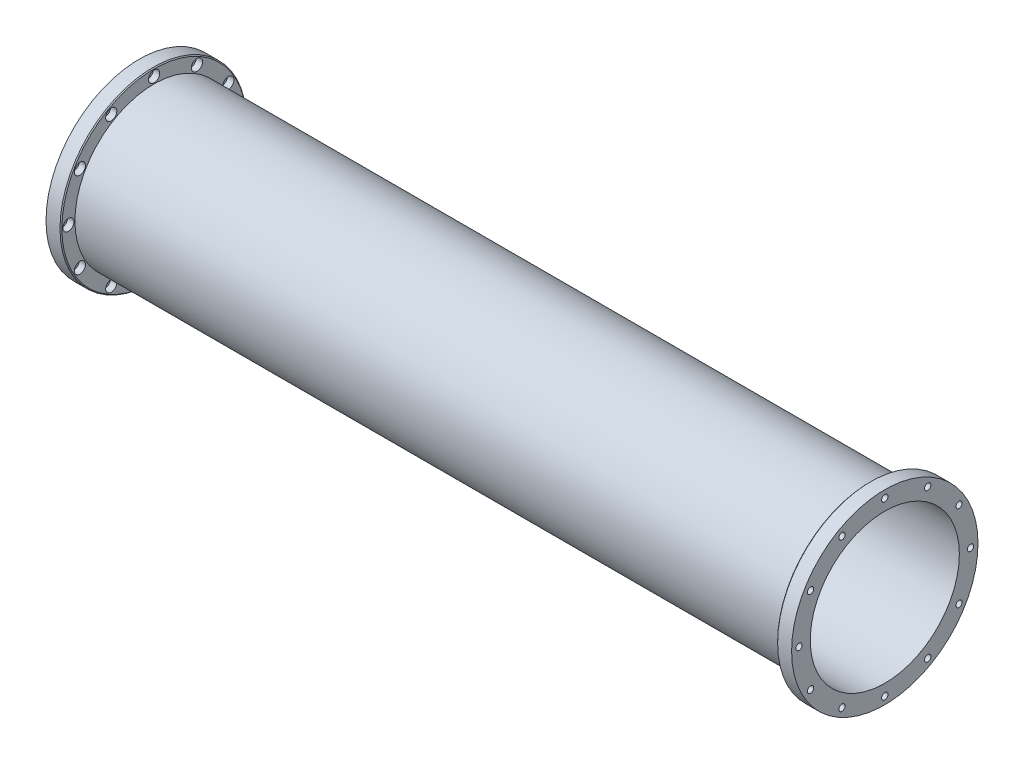
from build123d import *

# Parameters (mm, degrees)
SKETCH_4_R                = 40
CUT_EXTRUDE_1_DEPTH       = 407.201920232
HOLE_WIZARD_1_D           = 3.4
HOLE_WIZARD_1_DEPTH       = 8
HOLE_WIZARD_1_CBORE_D     = 6
HOLE_WIZARD_1_CBORE_DEPTH = 3.4
PATTERN_CIRCULAR_1_COUNT  = 12
HOLE_WIZARD_3_D           = 3.4
HOLE_WIZARD_3_DEPTH       = 8
HOLE_WIZARD_3_CBORE_D     = 6
HOLE_WIZARD_3_CBORE_DEPTH = 3.4
PATTERN_CIRCULAR_2_COUNT  = 12
CHAMFER_1_SIZE            = 0.5


with BuildPart() as part:
    # 草图3 → 旋转1 (revolve)
    with BuildSketch(Plane.XY, mode=Mode.PRIVATE) as revolve_1_sk:
        Polygon((0, 0), (0, 50), (8, 50), (8, 42.5), (392, 42.5), (392, 50), (400, 50), (400, 0), align=None)
    revolve(revolve_1_sk.sketch.rotate(Axis((-303.553299492, 0, 0), (1, 0, 0)), 90), axis=Axis((-303.553299492, 0, 0), (1, 0, 0)))

    # 草图4 → 切除-拉伸1 (cut, through all)
    with BuildSketch(Plane(origin=(400, 0, 0), x_dir=(0, 0, -1), z_dir=(1, 0, 0))):
        Circle(SKETCH_4_R)
    extrude(amount=-CUT_EXTRUDE_1_DEPTH, mode=Mode.SUBTRACT)

    # 打孔尺寸(%根据)内六角圆柱头螺钉的类型1
    with Locations(Plane.ZY.offset(-392)):
        with Locations((0, 46)):
            hole_wizard_1 = CounterBoreHole(HOLE_WIZARD_1_D / 2, HOLE_WIZARD_1_CBORE_D / 2, HOLE_WIZARD_1_CBORE_DEPTH, depth=HOLE_WIZARD_1_DEPTH)

    # 阵列(圆周)1: 打孔尺寸(%根据)内六角圆柱头螺钉的类型1 ×12 about axis
    pattern_circular_1_axis = Axis((0, 0, 0), (1, 0, 0))
    for i in range(1, PATTERN_CIRCULAR_1_COUNT):
        add(hole_wizard_1.rotate(pattern_circular_1_axis, i * 360 / PATTERN_CIRCULAR_1_COUNT), mode=Mode.SUBTRACT)

    # 打孔尺寸(%根据)内六角圆柱头螺钉的类型3
    with Locations(Plane(origin=(8, 0, 0), x_dir=(0, 0, -1), z_dir=(1, 0, 0))):
        with Locations((0, 46)):
            hole_wizard_3 = CounterBoreHole(HOLE_WIZARD_3_D / 2, HOLE_WIZARD_3_CBORE_D / 2, HOLE_WIZARD_3_CBORE_DEPTH, depth=HOLE_WIZARD_3_DEPTH)

    # 阵列(圆周)2: 打孔尺寸(%根据)内六角圆柱头螺钉的类型3 ×12 about axis
    pattern_circular_2_axis = Axis((0, 0, 0), (1, 0, 0))
    for i in range(1, PATTERN_CIRCULAR_2_COUNT):
        add(hole_wizard_3.rotate(pattern_circular_2_axis, i * 360 / PATTERN_CIRCULAR_2_COUNT), mode=Mode.SUBTRACT)

    # 倒角1
    chamfer_1_edges = [part.edges().sort_by_distance(p)[0] for p in [
        (392, 0, -50),
        (8, 0, -50),
    ]]
    chamfer(chamfer_1_edges, length=CHAMFER_1_SIZE)


solid = part.part
